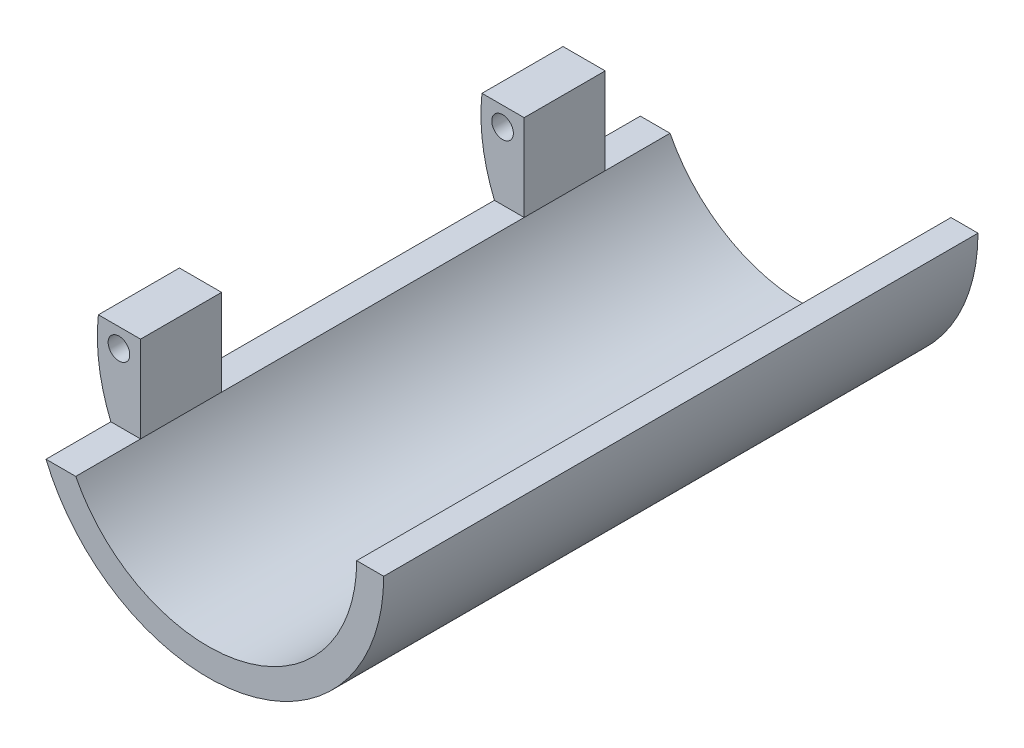
from build123d import *

# Parameters (mm, degrees)
CROQUIS2_R       = 2
PAREDMOVIL_DEPTH = 110
VISAGRA_REACH    = 130.083
CROQUIS3_W       = 12
CROQUIS3_H       = 16
CROQUIS3_W_2     = 56


with BuildPart() as part:
    # Croquis2 → ParedMovil (new body)
    with BuildSketch(Plane.XY):
        with BuildLine():
            Line((27.5, 0), (32.5, 0))
            ThreePointArc((32.5, 0), (-1.757573948, -32.452441107), (-32.309903619, 3.510004003))
            Line((-32.309903619, 3.510004003), (-24.5, 3.510004003))
            Line((-24.5, 3.510004003), (-24.5, -12.489995997))
            ThreePointArc((-24.5, -12.489995997), (6.422616289, -26.739483914), (27.5, 0))
        make_face()
        with Locations((-28.5, 0)):
            Circle(CROQUIS2_R, mode=Mode.SUBTRACT)
    extrude(amount=PAREDMOVIL_DEPTH)

    # Croquis3 → Visagra (cut, up to next)
    with BuildSketch(Plane(origin=(-24.5, 0, 0), x_dir=(0, 0, -1), z_dir=(1, 0, 0)), mode=Mode.PRIVATE) as visagra_sk1:
        with Locations((-104, -4.489995997)):
            Rectangle(CROQUIS3_W, CROQUIS3_H)
    visagra_tool1 = extrude(visagra_sk1.sketch, amount=-VISAGRA_REACH, mode=Mode.PRIVATE) & part.part
    # Croquis3 → Visagra (cut, up to next)
    with BuildSketch(Plane(origin=(-24.5, 0, 0), x_dir=(0, 0, -1), z_dir=(1, 0, 0)), mode=Mode.PRIVATE) as visagra_sk2:
        with Locations((-6, -4.489995997)):
            Rectangle(CROQUIS3_W, CROQUIS3_H)
    visagra_tool2 = extrude(visagra_sk2.sketch, amount=-VISAGRA_REACH, mode=Mode.PRIVATE) & part.part
    # Croquis3 → Visagra (cut, up to next)
    with BuildSketch(Plane(origin=(-24.5, 0, 0), x_dir=(0, 0, -1), z_dir=(1, 0, 0)), mode=Mode.PRIVATE) as visagra_sk3:
        with Locations((-55, -4.489995997)):
            Rectangle(CROQUIS3_W_2, CROQUIS3_H)
    visagra_tool3 = extrude(visagra_sk3.sketch, amount=-VISAGRA_REACH, mode=Mode.PRIVATE) & part.part
    add(visagra_tool1.solids().sort_by_distance((-24.5, -4.489996, 104))[0], mode=Mode.SUBTRACT)
    add(visagra_tool2.solids().sort_by_distance((-24.5, -4.489996, 6))[0], mode=Mode.SUBTRACT)
    add(visagra_tool3.solids().sort_by_distance((-24.5, -4.489996, 55))[0], mode=Mode.SUBTRACT)


solid = part.part
